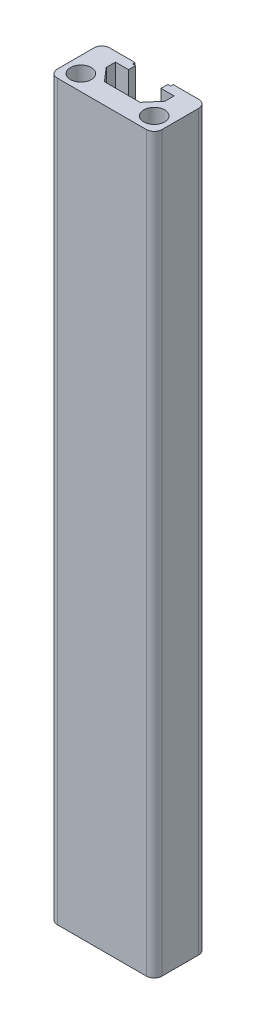
from build123d import *

# Parameters (mm, degrees)
SKETCH_1_R      = 2
EXTRUDE_1_DEPTH = 140
FILLET_1_R      = 1.5


with BuildPart() as part:
    # 草图1 → 凸台-拉伸1 (new body)
    with BuildSketch(Plane(origin=(0, 0, 0), x_dir=(1, 0, 0), z_dir=(0, 1, 0))):
        Polygon((0, 0), (20, 0), (20, 10), (13.65, 10), (13.65, 9.510427602), (13.1, 9.510427602), (13.1, 8.2), (15.6, 8.2), (15.6, 6.447507136), (13.412706863, 3.9), (6.587293137, 3.9), (4.4, 6.447507136), (4.4, 8.2), (6.9, 8.2), (6.9, 9.510427602), (6.35, 9.510427602), (6.35, 10), (0, 10), align=None)
        with Locations(Location((3, 3, 0), (0, 0, 270))):
            Circle(SKETCH_1_R, mode=Mode.SUBTRACT)
        with Locations(Location((17, 3, 0), (0, 0, 270))):
            Circle(SKETCH_1_R, mode=Mode.SUBTRACT)
    extrude(amount=EXTRUDE_1_DEPTH)

    # 圆角1
    fillet_1_edges = [part.edges().sort_by_distance(p)[0] for p in [
        (0, 70, -10),
        (20, 70, -10),
        (20, 70, 0),
        (0, 70, 0),
    ]]
    fillet(fillet_1_edges, radius=FILLET_1_R)


solid = part.part
